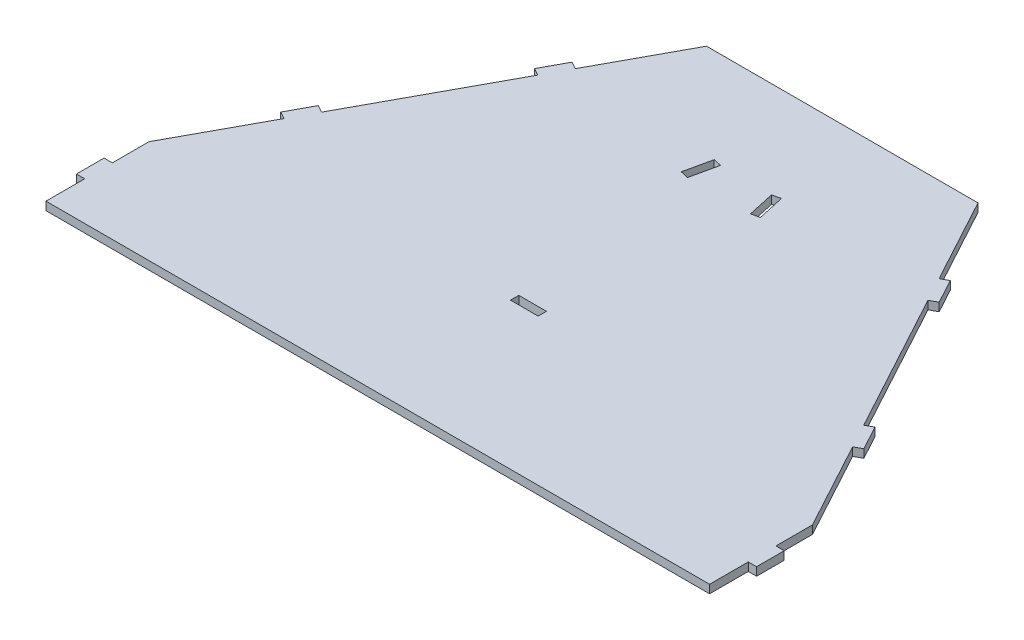
from build123d import *

# Parameters (mm, degrees)
BOSS_EXTRUDE1_DEPTH = 3
SKETCH2_W           = 10
SKETCH2_H           = 3
CUT_EXTRUDE3_DEPTH  = 10


with BuildPart() as part:
    # Sketch1 → Boss-Extrude1 (new body)
    with BuildSketch(Plane(origin=(0, 0, 0), x_dir=(1, 0, 0), z_dir=(0, 1, 0))):
        Polygon((-123, 0), (123, 0), (123, 38), (52.5, 168), (-52.5, 168), (-123, 38), align=None)
    extrude(amount=BOSS_EXTRUDE1_DEPTH)

    # Sketch2 → Cut-Extrude3 (cut)
    with BuildSketch(Plane(origin=(0, 3, 0), x_dir=(1, 0, 0), z_dir=(0, 1, 0))):
        Polygon((120, 3), (120, 0), (123, 0), (123, 14), (120, 14), align=None)
        Polygon((120, 37.23889635), (120, 24), (123, 24), (123, 38), (105.456749613, 70.349256033), (102.819582002, 68.919099751), align=None)
        Polygon((70.539591859, 128.44248583), (98.052394397, 77.709658456), (100.689562008, 79.139814737), (73.17675947, 129.872642111), align=None)
        Polygon((50.714170713, 165), (65.772404254, 137.233044534), (68.409571865, 138.663200816), (52.5, 168), (49.087247636, 168), align=None)
        Polygon((14.314512119, 124.067092532), (11.385651621, 123.417649552), (9.220841688, 133.180517879), (12.149702186, 133.829960859), align=None)
        Polygon((-12.149702186, 133.829960859), (-14.314512119, 124.067092532), (-11.385651621, 123.417649552), (-9.220841688, 133.180517879), align=None)
        with Locations((0, 54.5)):
            Rectangle(SKETCH2_W, SKETCH2_H)
        Polygon((-52.5, 168), (-68.409571865, 138.663200816), (-65.772404254, 137.233044534), (-50.714170713, 165), (-49.087247636, 168), align=None)
        Polygon((-73.17675947, 129.872642111), (-100.689562008, 79.139814737), (-98.052394397, 77.709658456), (-70.539591859, 128.44248583), align=None)
        Polygon((-123, 14), (-123, 0), (-120, 0), (-120, 3), (-120, 14), align=None)
        Polygon((-123, 38), (-123, 24), (-120, 24), (-120, 37.23889635), (-102.819582002, 68.919099751), (-105.456749613, 70.349256033), align=None)
    extrude(amount=-CUT_EXTRUDE3_DEPTH, mode=Mode.SUBTRACT)


solid = part.part
